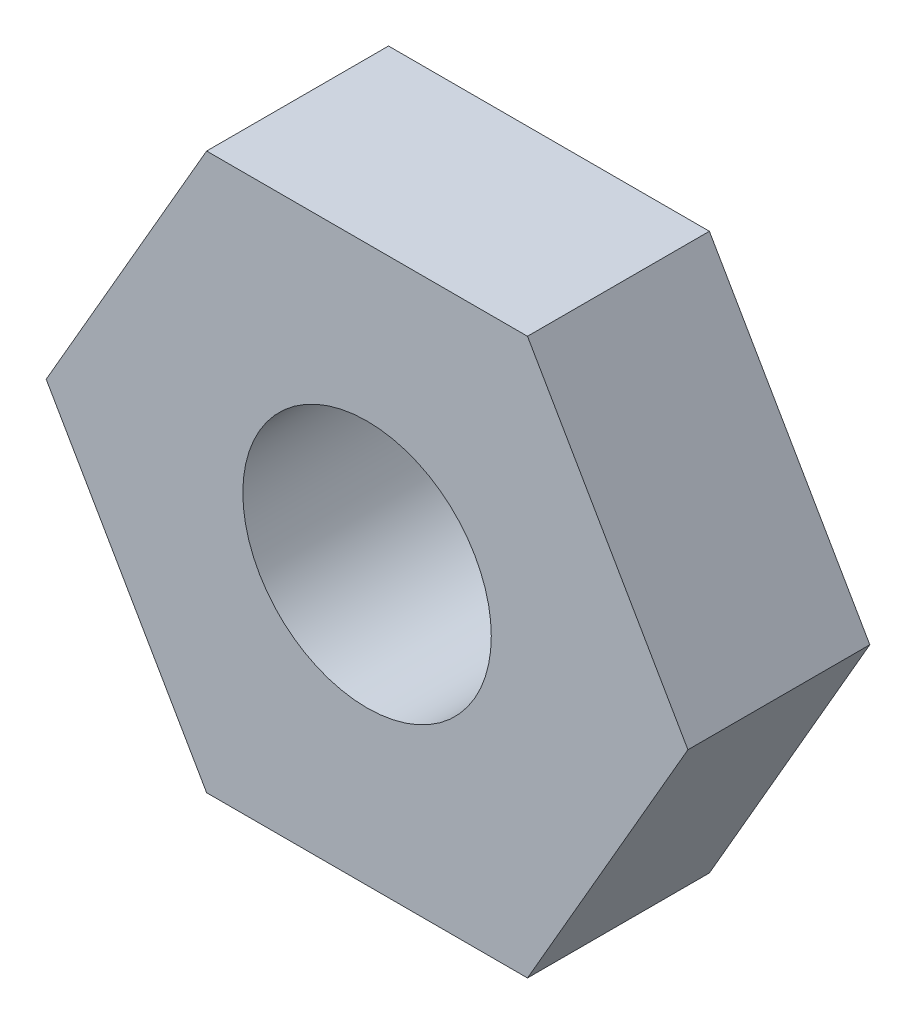
from build123d import *

# Parameters (mm, degrees)
SKETCH1_R     = 1.2295
BASENUT_DEPTH = 1.8


with BuildPart() as part:
    # Sketch1 → BaseNut (new body)
    with BuildSketch(Plane.XY):
        Polygon((1.58771324, -2.75), (3.175426481, 0), (1.58771324, 2.75), (-1.58771324, 2.75), (-3.175426481, 0), (-1.58771324, -2.75), align=None)
        Circle(SKETCH1_R, mode=Mode.SUBTRACT)
    extrude(amount=-BASENUT_DEPTH)


solid = part.part
